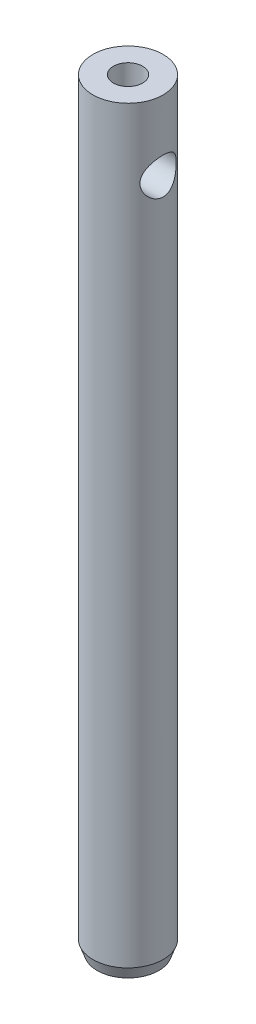
from build123d import *

# Parameters (mm, degrees)
SKETCH1_W                  = 3
SKETCH1_H                  = 65
CUT_EXTRUDE1_DEPTH         = 66.138314378
CUT_EXTRUDE1_DEPTH_BACK    = 66.138314378
SKETCH2_R                  = 1.55
M3X0_5_TAPPED_HOLE1_REACH  = 67.138
M3X0_5_TAPPED_HOLE1_BORE_R = 1.25
CHAMFER1_SIZE              = 1
CHAMFER1_SIZE2             = 0.363970234


with BuildPart() as part:
    # Sketch1 → Revolve1 (revolve)
    with BuildSketch(Plane.XY, mode=Mode.PRIVATE) as revolve1_sk:
        with Locations((1.5, 32.5)):
            Rectangle(SKETCH1_W, SKETCH1_H)
    revolve(revolve1_sk.sketch.rotate(Axis((0, -5.428885746, 0), (0, 1, 0)), 90), axis=Axis((0, -5.428885746, 0), (0, 1, 0)))

    # Sketch2 → Cut-Extrude1 (cut, two sides: drawn at the far end of the back side and taken through both)
    with BuildSketch(Plane(origin=(0, 0, 0), x_dir=(0, 0, -1), z_dir=(1, 0, 0)).offset(-CUT_EXTRUDE1_DEPTH_BACK)):
        with Locations((0, 59)):
            Circle(SKETCH2_R)
    extrude(amount=CUT_EXTRUDE1_DEPTH + CUT_EXTRUDE1_DEPTH_BACK, mode=Mode.SUBTRACT)

    # M3x0.5 Tapped Hole1 bore → M3x0.5 Tapped Hole1 (cut, up to next)
    with BuildSketch(Plane(origin=(0, 65, 0), x_dir=(-1, 0, 0), z_dir=(0, 1, 0)), mode=Mode.PRIVATE) as m3x0_5_tapped_hole1_sk1:
        Circle(M3X0_5_TAPPED_HOLE1_BORE_R)
    m3x0_5_tapped_hole1_tool1 = extrude(m3x0_5_tapped_hole1_sk1.sketch, amount=-M3X0_5_TAPPED_HOLE1_REACH, mode=Mode.PRIVATE) & part.part
    add(m3x0_5_tapped_hole1_tool1.solids().sort_by_distance((0, 65, 0))[0], mode=Mode.SUBTRACT)

    # Chamfer1
    chamfer1_edges = [part.edges().sort_by_distance(p)[0] for p in [
        (0, 0, 3),
    ]]
    chamfer1_side = [part.faces().sort_by_distance(p)[0] for p in [
        (0, 32.5, 3),
    ]]
    chamfer(chamfer1_edges, length=CHAMFER1_SIZE, length2=CHAMFER1_SIZE2, reference=chamfer1_side[0])


solid = part.part
